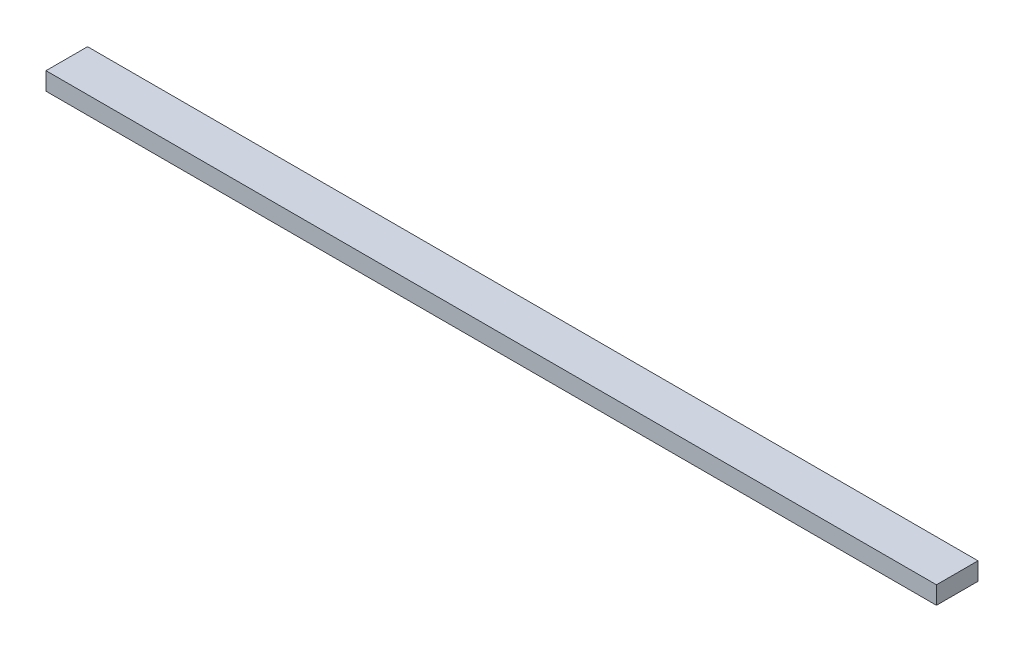
from build123d import *

# Parameters (mm, degrees)
SKETCH1_W           = 44.45
SKETCH1_H           = 19.05
BOSS_EXTRUDE1_DEPTH = 476.25


with BuildPart() as part:
    # Sketch1 → Boss-Extrude1 (new, symmetric)
    with BuildSketch(Plane(origin=(0, 0, 0), x_dir=(0, 0, -1), z_dir=(1, 0, 0))):
        Rectangle(SKETCH1_W, SKETCH1_H)
    extrude(amount=BOSS_EXTRUDE1_DEPTH, both=True)


solid = part.part
